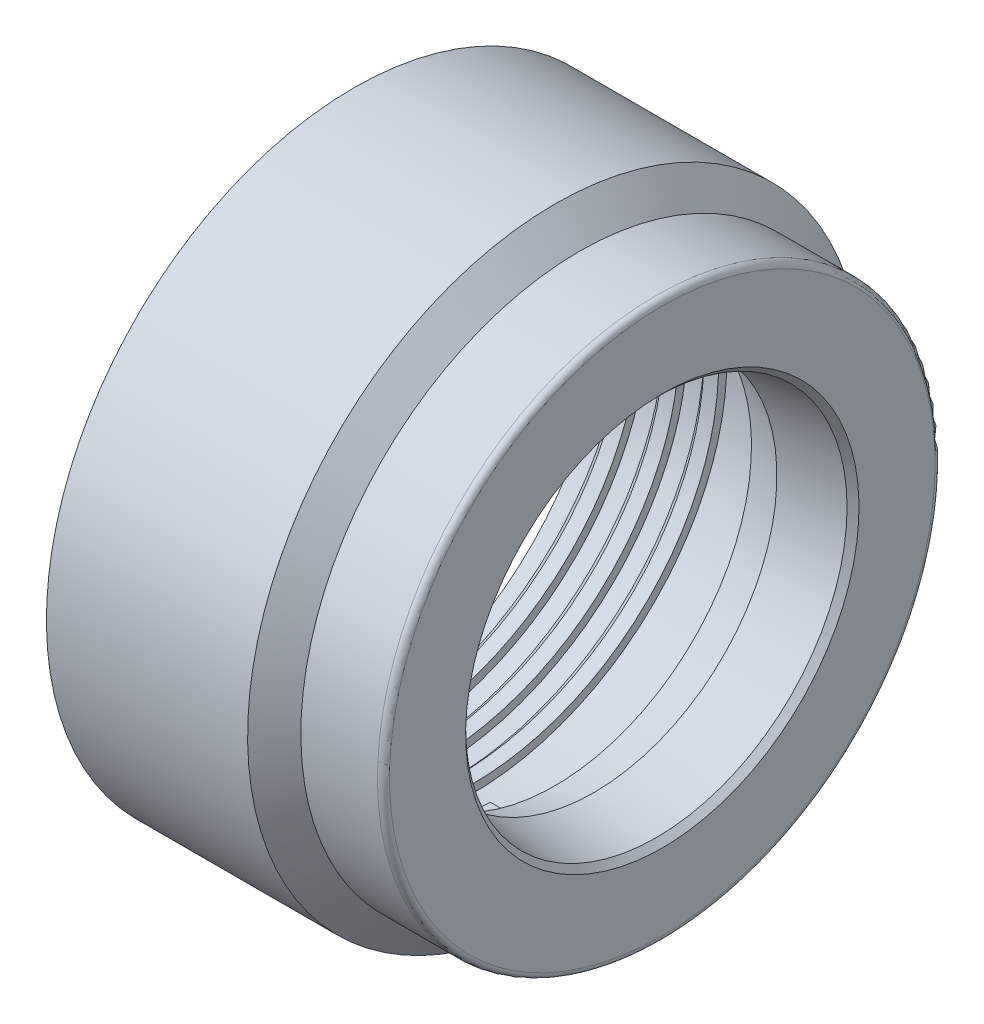
from build123d import *

# Parameters (mm, degrees)
SWEEP1_PITCH       = 16.51
SWEEP1_HEIGHT      = 49.53
SWEEP1_RADIUS      = 105.691730701
SWEEP1_START_ANGLE = 90


with BuildPart() as part:
    # Sketch1 → Revolve1 (revolve)
    with BuildSketch(Plane.XY):
        with BuildLine():
            Line((0, 3.787125453), (-2.512581748, 1.274543705))
            Line((-2.512581748, 1.274543705), (-28.748040506, -1.99129637))
            Line((-28.748040506, -1.99129637), (-28.748040506, 1.274543705))
            Line((-28.748040506, 1.274543705), (-45.138961745, 3.724925992))
            Line((-45.138961745, 3.724925992), (-45.138961745, 24.245250787))
            ThreePointArc((-45.138961745, 24.245250787), (-45.88291052, 26.041302012), (-47.678961745, 26.785250787))
            Line((-47.678961745, 26.785250787), (-129.706461558, 26.785250787))
            Line((-129.706461558, 26.785250787), (-129.706461558, 50.296383196))
            Line((-129.706461558, 50.296383196), (-45.138961745, 50.296383196))
            Line((-45.138961745, 50.296383196), (-34.748630615, 38.298731402))
            Line((-34.748630615, 38.298731402), (-2.54, 38.298731402))
            ThreePointArc((-2.54, 38.298731402), (-0.743948776, 37.554782626), (0, 35.758731402))
            Line((0, 35.758731402), (0, 3.787125453))
        make_face()
    revolve(axis=Axis((-3.886465032, -78.906479914, 0), (-1, 0, 0)))

    # Sweep1: sweep along a helix
    with BuildLine() as sweep1_path:
        add(Helix(SWEEP1_PITCH, SWEEP1_HEIGHT, SWEEP1_RADIUS, center=(-66.206461558, -78.906479914, 0), direction=(-1, 0, 0), mode=Mode.PRIVATE).rotate(Axis((-66.206461558, -78.906479914, 0), (-1, 0, 0)), SWEEP1_START_ANGLE))
    # Sketch4 → Sweep1 (sweep)
    with BuildSketch(Plane.XY):
        Polygon((-66.206461558, -184.907192532), (-76.112461558, -184.907192532), (-72.302461558, -181.097192532), (-66.206461558, -181.097192532), align=None)
    sweep(path=sweep1_path.line, is_frenet=True)


solid = part.part
